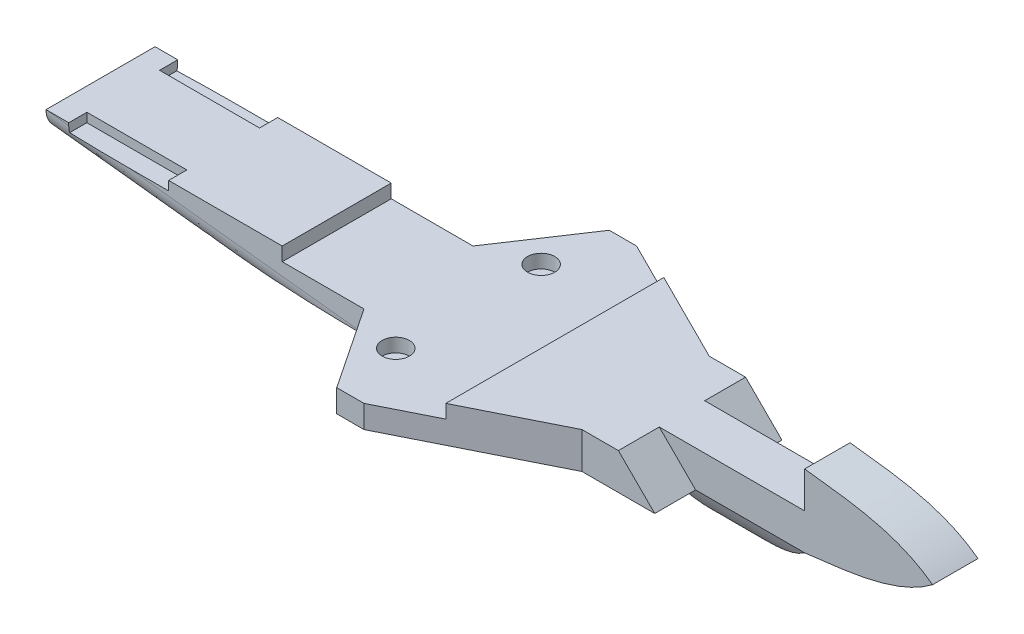
from build123d import *

# Parameters (mm, degrees)
BOSS_EXTRUDE1_DEPTH     = 4
SKETCH2_R               = 1.5
BOSS_EXTRUDE2_DEPTH     = 3
CUT_EXTRUDE1_DEPTH      = 13
CUT_EXTRUDE2_DEPTH      = 49
CUT_EXTRUDE3_DEPTH      = 49
CUT_EXTRUDE3_DEPTH_BACK = 3
SKETCH5_R               = 1.5
CUT_EXTRUDE4_DEPTH      = 41
SKETCH7_W               = 11
SKETCH7_H               = 1
CUT_EXTRUDE5_DEPTH      = 2
CUT_EXTRUDE6_START      = -12
SKETCH7_2_W             = 11
SKETCH7_2_H             = 1
CUT_EXTRUDE6_DEPTH      = 2
SKETCH8_W               = 11
SKETCH8_H               = 2
CUT_EXTRUDE7_DEPTH      = 1
SKETCH9_W               = 14
SKETCH9_H               = 4
BOSS_EXTRUDE3_DEPTH     = 15
CUT_EXTRUDE8_DEPTH      = 15
SKETCH12_W              = 12
SKETCH12_H              = 4.5
CUT_EXTRUDE9_DEPTH      = 15
BOSS_EXTRUDE4_START     = -4.5
BOSS_EXTRUDE4_DEPTH     = 5
CUT_EXTRUDE10_DEPTH     = 4.5
CUT_EXTRUDE11_START     = -14
CUT_EXTRUDE11_DEPTH     = 4.5


with BuildPart() as part:
    # Sketch1 → Boss-Extrude1 (new body)
    with BuildSketch(Plane(origin=(0, 0, 0), x_dir=(1, 0, 0), z_dir=(0, 1, 0))):
        Polygon((-1, 15), (2, 15), (18, 7), (23, 7), (23, -7), (18, -7), (2, -15), (-1, -15), (-7, -6), (-42, -6), (-42, 6), (-7, 6), align=None)
    extrude(amount=BOSS_EXTRUDE1_DEPTH)

    # Sketch2 → Boss-Extrude2 (add)
    with BuildSketch(Plane(origin=(0, 4, 0), x_dir=(1, 0, 0), z_dir=(0, 1, 0))):
        with Locations(Location((-1.5, 8, 0), (0, 0, 270))):
            Circle(SKETCH2_R)
        with Locations(Location((-1.5, -8, 0), (0, 0, 90))):
            Circle(SKETCH2_R)
    extrude(amount=BOSS_EXTRUDE2_DEPTH)

    # Sketch3 → Cut-Extrude1 (cut)
    with BuildSketch(Plane.XY.offset(6)):
        Polygon((-24, 0), (-42, 2), (-42, 0), align=None)
    extrude(amount=-CUT_EXTRUDE1_DEPTH, mode=Mode.SUBTRACT)

    # Sketch4 → Cut-Extrude2 (cut, along a direction that is not the sketch's normal)
    with BuildSketch(Plane.ZY.offset(42)):
        with BuildLine():
            ThreePointArc((-5, 2), (-5.736067977, 2.881966011), (-6, 4))
            Line((-6, 4), (-6, 2))
            Line((-6, 2), (-5, 2))
        make_face()
        with BuildLine():
            Line((1.25, 2.910275264), (-1.25, 2.910275264))
            ThreePointArc((-1.25, 2.910275264), (-1.570550528, 2.410275264), (-2, 2))
            Line((-2, 2), (2, 2))
            ThreePointArc((2, 2), (1.570550528, 2.410275264), (1.25, 2.910275264))
        make_face()
        with BuildLine():
            Line((5, 2), (6, 2))
            Line((6, 2), (6, 4))
            ThreePointArc((6, 4), (5.736067977, 2.881966011), (5, 2))
        make_face()
    extrude(amount=-CUT_EXTRUDE2_DEPTH, dir=(-0.9938837346736189, 0.11043152607484653, 0), mode=Mode.SUBTRACT)

    # Sketch5 → Cut-Extrude3 (cut, two sides: drawn at the far end of the back side and taken through both)
    with BuildSketch(Plane(origin=(0, 4, 0), x_dir=(1, 0, 0), z_dir=(0, 1, 0)).offset(-CUT_EXTRUDE3_DEPTH_BACK)):
        with Locations(Location((-1.5, 8, 0), (0, 0, 270))):
            Circle(SKETCH5_R)
        with Locations(Location((-1.5, -8, 0), (0, 0, 270))):
            Circle(SKETCH5_R)
    extrude(amount=CUT_EXTRUDE3_DEPTH + CUT_EXTRUDE3_DEPTH_BACK, mode=Mode.SUBTRACT)

    # Sketch6 → Cut-Extrude4 (cut)
    with BuildSketch(Plane.XY.offset(15)):
        Polygon((-7, 4), (8, 4), (8, 2.5), (-7, 2.5), (-16, 2.5), (-16, 4), align=None)
    extrude(amount=-CUT_EXTRUDE4_DEPTH, mode=Mode.SUBTRACT)

    # Sketch7 → Cut-Extrude5 (cut)
    with BuildSketch(Plane.XY.offset(6)):
        with Locations((-34, 3.5)):
            Rectangle(SKETCH7_W, SKETCH7_H)
    extrude(amount=-CUT_EXTRUDE5_DEPTH, mode=Mode.SUBTRACT)

    # Sketch7<2> → Cut-Extrude6 (cut)
    with BuildSketch(Plane.XY.offset(6).offset(CUT_EXTRUDE6_START)):
        with Locations((-34, 3.5)):
            Rectangle(SKETCH7_2_W, SKETCH7_2_H)
    extrude(amount=CUT_EXTRUDE6_DEPTH, mode=Mode.SUBTRACT)

    # Sketch8 → Cut-Extrude7 (cut)
    with BuildSketch(Plane(origin=(-0.292682927, -2.634146341, 0), x_dir=(0.9938837346736189, -0.11043152607484653, 0), z_dir=(-0.11043152607484653, -0.9938837346736189, 0))):
        with Locations((-33.963979908, -3.5)):
            Rectangle(SKETCH8_W, SKETCH8_H)
        with Locations((-33.963979908, 3.5)):
            Rectangle(SKETCH8_W, SKETCH8_H)
    extrude(amount=-CUT_EXTRUDE7_DEPTH, mode=Mode.SUBTRACT)

    # Sketch9 → Boss-Extrude3 (add)
    with BuildSketch(Plane(origin=(23, 0, 0), x_dir=(0, 0, -1), z_dir=(1, 0, 0))):
        with Locations((0, 2)):
            Rectangle(SKETCH9_W, SKETCH9_H)
        with BuildLine():
            add(Edge.make_bspline(
                [(2.5, 0), (0.172282059, -6.003423798), (-2.5, 0)],
                knots=[0, 0, 0, 1, 1, 1], degree=2))
            Line((2.5, 0), (-2.5, 0))
        make_face()
    extrude(amount=BOSS_EXTRUDE3_DEPTH)

    # Sketch10 → Cut-Extrude8 (cut)
    with BuildSketch(Plane(origin=(0, 0, -7), x_dir=(-1, 0, 0), z_dir=(0, 0, -1))):
        with BuildLine():
            Line((-23, 0), (-23, -3.001711899))
            Line((-23, -3.001711899), (-38, -3.001711899))
            Line((-38, -3.001711899), (-38, 0))
            add(Edge.make_bspline(
                [(-23, 0), (-25.315557178, -3.079564153), (-31.097350972, -3.102014712), (-36.3128438, -1.382343261), (-38, 0)],
                knots=[0, 0, 0, 0, 0.604336881, 1, 1, 1, 1], degree=3))
        make_face()
    extrude(amount=-CUT_EXTRUDE8_DEPTH, mode=Mode.SUBTRACT)

    # Sketch12 → Cut-Extrude9 (cut)
    with BuildSketch(Plane.XZ):
        with Locations((32, -4.75)):
            Rectangle(SKETCH12_W, SKETCH12_H)
        with Locations((32, 4.75)):
            Rectangle(SKETCH12_W, SKETCH12_H)
    extrude(amount=-CUT_EXTRUDE9_DEPTH, mode=Mode.SUBTRACT)

    # Sketch10<4> → Boss-Extrude4 (add)
    with BuildSketch(Plane(origin=(0, 0, -7), x_dir=(-1, 0, 0), z_dir=(0, 0, -1)).offset(BOSS_EXTRUDE4_START)):
        with BuildLine():
            add(Edge.make_bspline(
                [(-38, 0), (-42.812604694, 0.581647057), (-48.098359819, 1.012932082), (-52.080952957, 4)],
                knots=[0, 0, 0, 0, 1, 1, 1, 1], degree=3))
            Line((-52.080952957, 4), (-38, 4))
            Line((-38, 4), (-38, 0))
        make_face()
        with BuildLine():
            Line((-52.080952957, 4), (-38, 4))
            Line((-38, 4), (-38, 8))
            add(Edge.make_bspline(
                [(-38, 8), (-42.812604694, 7.418352943), (-48.098359819, 6.987067918), (-52.080952957, 4)],
                knots=[0, 0, 0, 0, 1, 1, 1, 1], degree=3))
        make_face()
    extrude(amount=-BOSS_EXTRUDE4_DEPTH)

    # Sketch13 → Cut-Extrude10 (cut)
    with BuildSketch(Plane.XY.offset(7)):
        Polygon((22, 4), (26, 0), (26, 4), align=None)
    extrude(amount=-CUT_EXTRUDE10_DEPTH, mode=Mode.SUBTRACT)

    # Sketch13<2> → Cut-Extrude11 (cut)
    with BuildSketch(Plane.XY.offset(7).offset(CUT_EXTRUDE11_START)):
        Polygon((22, 4), (26, 0), (26, 4), align=None)
    extrude(amount=CUT_EXTRUDE11_DEPTH, mode=Mode.SUBTRACT)


solid = part.part
